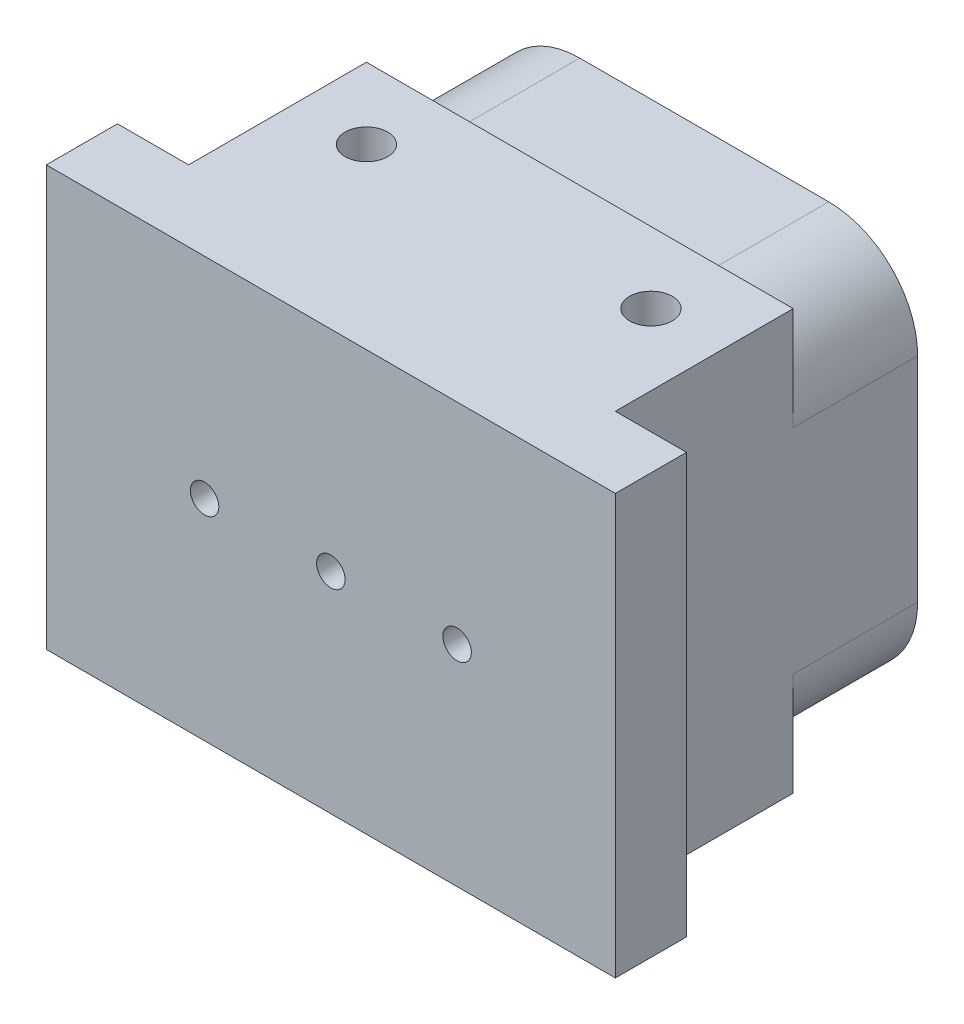
from build123d import *

# Parameters (mm, degrees)
BOSS_EXTRUDE1_DEPTH     = 11.8
BOSS_EXTRUDE2_DEPTH     = 10.5
CUT_EXTRUDE1_DEPTH      = 18.705648816
CUT_EXTRUDE1_DEPTH_BACK = 18.705648816
SKETCH2_R               = 0.6
SKETCH5_R               = 1.625
CUT_EXTRUDE2_DEPTH      = 1.6
CUT_EXTRUDE5_DEPTH      = 17.806248838
CUT_EXTRUDE5_DEPTH_BACK = 17.806248838
SKETCH7_R               = 0.4


with BuildPart() as part:
    # Sketch1 → Boss-Extrude1 (new body)
    with BuildSketch(Plane(origin=(0, 0, 0), x_dir=(1, 0, 0), z_dir=(0, 1, 0))):
        Polygon((0, 0), (8, 0), (8, 2), (6, 2), (6, 7), (-6, 7), (-6, 2), (-8, 2), (-8, 0), align=None)
    extrude(amount=BOSS_EXTRUDE1_DEPTH)

    # Sketch4 → Boss-Extrude2 (add)
    with BuildSketch(Plane.XY):
        with BuildLine():
            Line((-6, 8.9), (-6, 2.9))
            ThreePointArc((-6, 2.9), (-5.267766953, 1.132233047), (-3.5, 0.4))
            Line((-3.5, 0.4), (3.5, 0.4))
            ThreePointArc((3.5, 0.4), (5.267766953, 1.132233047), (6, 2.9))
            Line((6, 2.9), (6, 8.9))
            ThreePointArc((6, 8.9), (5.267766953, 10.667766953), (3.5, 11.4))
            Line((3.5, 11.4), (-3.5, 11.4))
            ThreePointArc((-3.5, 11.4), (-5.267766953, 10.667766953), (-6, 8.9))
        make_face()
    extrude(amount=-BOSS_EXTRUDE2_DEPTH)

    # Sketch2 → Cut-Extrude1 (cut, two sides: drawn at the far end of the back side and taken through both)
    with BuildSketch(Plane(origin=(0, 11.8, 0), x_dir=(1, 0, 0), z_dir=(0, 1, 0)).offset(-CUT_EXTRUDE1_DEPTH_BACK)):
        with Locations(Location((-4, 5, 0), (0, 0, 270))):
            Circle(SKETCH2_R)
        with Locations(Location((4, 5, 0), (0, 0, 270))):
            Circle(SKETCH2_R)
    extrude(amount=CUT_EXTRUDE1_DEPTH + CUT_EXTRUDE1_DEPTH_BACK, mode=Mode.SUBTRACT)

    # Sketch5 → Cut-Extrude2 (cut)
    with BuildSketch(Plane(origin=(0, 0, -10.5), x_dir=(-1, 0, 0), z_dir=(0, 0, -1))):
        with Locations((3.55, 5.9)):
            Circle(SKETCH5_R)
        with Locations((-3.55, 5.9)):
            Circle(SKETCH5_R)
        with Locations((0, 5.9)):
            Circle(SKETCH5_R)
    extrude(amount=-CUT_EXTRUDE2_DEPTH, mode=Mode.SUBTRACT)

    # Sketch7 → Cut-Extrude5 (cut, two sides: drawn at the far end of the back side and taken through both)
    with BuildSketch(Plane(origin=(0, 0, -8.9), x_dir=(-1, 0, 0), z_dir=(0, 0, -1)).offset(-CUT_EXTRUDE5_DEPTH_BACK)):
        with Locations((-3.55, 5.9)):
            Circle(SKETCH7_R)
        with Locations((3.55, 5.9)):
            Circle(SKETCH7_R)
        with Locations((0, 5.9)):
            Circle(SKETCH7_R)
    extrude(amount=CUT_EXTRUDE5_DEPTH + CUT_EXTRUDE5_DEPTH_BACK, mode=Mode.SUBTRACT)


solid = part.part
